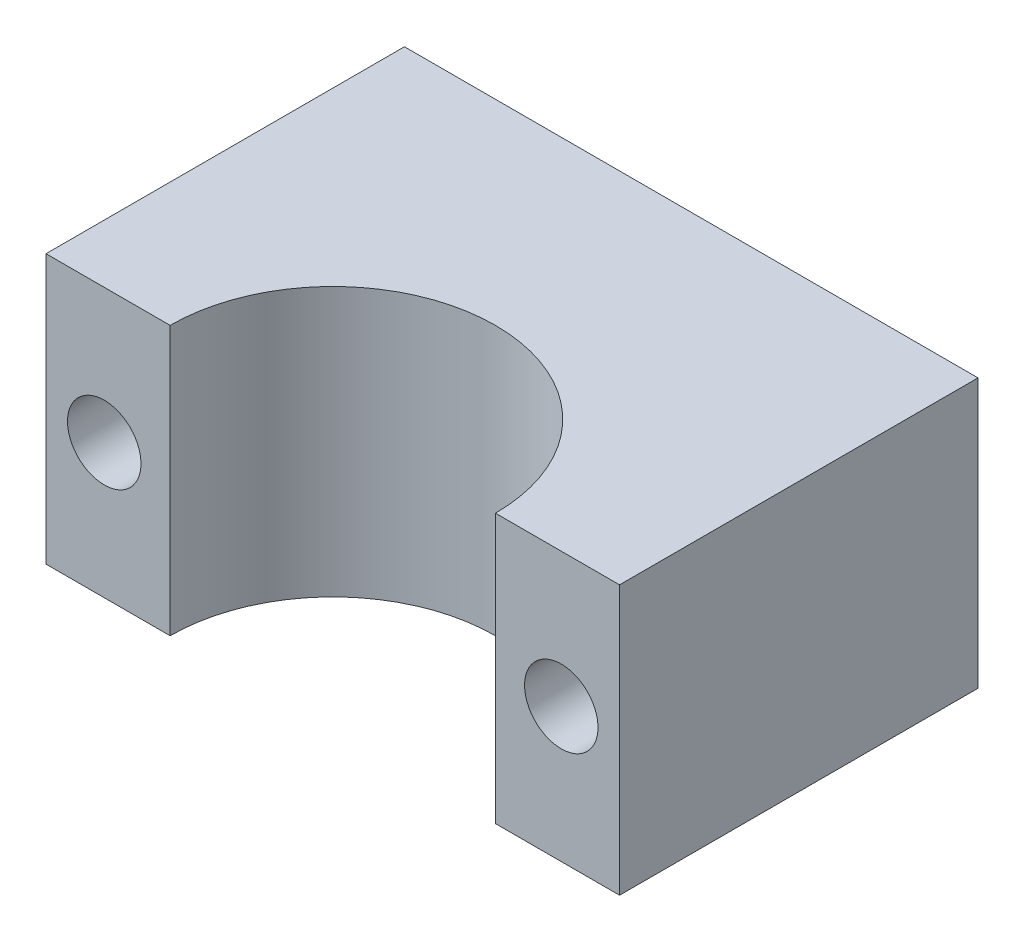
from build123d import *

# Parameters (mm, degrees)
BOSS_EXTRUDE1_DEPTH     = 15
CUT_EXTRUDE1_DEPTH      = 30.681644159
CUT_EXTRUDE1_DEPTH_BACK = 30.681644159
SKETCH3_R               = 2.05


with BuildPart() as part:
    # Sketch2 → Boss-Extrude1 (new body)
    with BuildSketch(Plane(origin=(0, 0, 0), x_dir=(1, 0, 0), z_dir=(0, 1, 0))):
        with BuildLine():
            Line((-16, 20), (16, 20))
            Line((16, 20), (16, 0))
            Line((16, 0), (9.075, 0))
            ThreePointArc((9.075, 0), (0, 9.075), (-9.075, 0))
            Line((-9.075, 0), (-16, 0))
            Line((-16, 0), (-16, 20))
        make_face()
    extrude(amount=BOSS_EXTRUDE1_DEPTH)

    # Sketch3 → Cut-Extrude1 (cut, two sides: drawn at the far end of the back side and taken through both)
    with BuildSketch(Plane(origin=(0, 0, -20), x_dir=(-1, 0, 0), z_dir=(0, 0, -1)).offset(-CUT_EXTRUDE1_DEPTH_BACK)):
        with Locations((-12.75, 7.5)):
            Circle(SKETCH3_R)
        with Locations((12.75, 7.5)):
            Circle(SKETCH3_R)
    extrude(amount=CUT_EXTRUDE1_DEPTH + CUT_EXTRUDE1_DEPTH_BACK, mode=Mode.SUBTRACT)


solid = part.part
